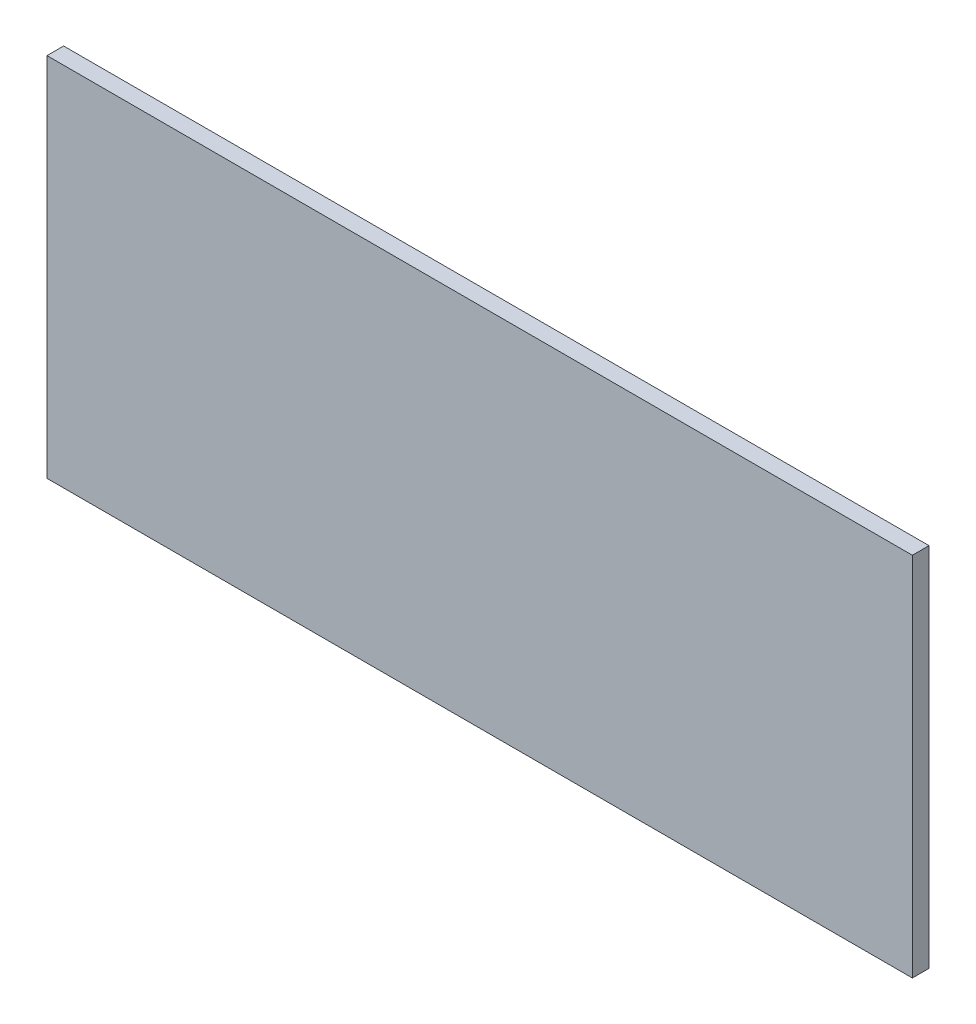
from build123d import *

# Parameters (mm, degrees)
SKETCH1_W           = 156
SKETCH1_H           = 66
BOSS_EXTRUDE1_DEPTH = 3


with BuildPart() as part:
    # Sketch1 → Boss-Extrude1 (new body)
    with BuildSketch(Plane.XY):
        Rectangle(SKETCH1_W, SKETCH1_H)
    extrude(amount=BOSS_EXTRUDE1_DEPTH)


solid = part.part
